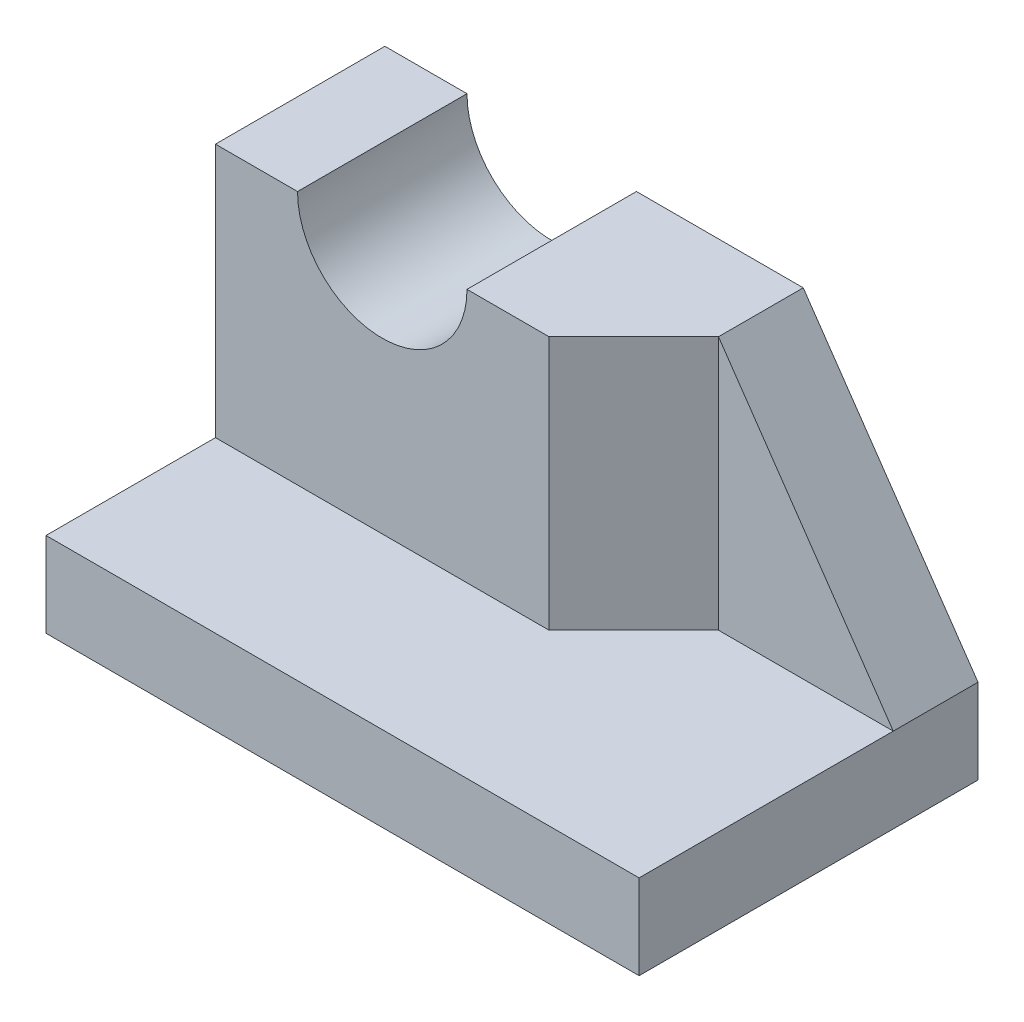
from build123d import *

# Parameters (mm, degrees)
SKETCH1_W               = 70
SKETCH1_H               = 40
BOSS_EXTRUDE1_DEPTH     = 10
BOSS_EXTRUDE2_DEPTH     = 30
CUT_EXTRUDE1_DEPTH      = 57.789083458
CUT_EXTRUDE1_DEPTH_BACK = 57.789083458
SKETCH3_OUTSIDE_W       = 90
SKETCH3_OUTSIDE_H       = 60


with BuildPart() as part:
    # Sketch1 → Boss-Extrude1 (new body)
    with BuildSketch(Plane(origin=(0, 0, 0), x_dir=(1, 0, 0), z_dir=(0, 1, 0))):
        Rectangle(SKETCH1_W, SKETCH1_H)
    extrude(amount=BOSS_EXTRUDE1_DEPTH)

    # Sketch2 → Boss-Extrude2 (add)
    with BuildSketch(Plane(origin=(0, 10, 0), x_dir=(1, 0, 0), z_dir=(0, 1, 0))):
        Polygon((-35, 20), (-35, 0), (4.372843299, 0), (14.372843299, 10), (35, 10), (35, 20), align=None)
    extrude(amount=BOSS_EXTRUDE2_DEPTH)

    # Sketch3 outside → Cut-Extrude1 (cut, two sides: drawn at the far end of the back side and taken through both)
    with BuildSketch(Plane.XY.offset(-CUT_EXTRUDE1_DEPTH_BACK)):
        with Locations((0, 20)):
            Rectangle(SKETCH3_OUTSIDE_W, SKETCH3_OUTSIDE_H)
        with BuildLine():
            Line((-25.31357835, 40), (-35, 40))
            Line((-35, 40), (-35, 0))
            Line((-35, 0), (35, 0))
            Line((35, 0), (35, 10))
            Line((35, 10), (14.372843299, 40))
            Line((14.372843299, 40), (-5.31357835, 40))
            ThreePointArc((-5.31357835, 40), (-15.31357835, 30), (-25.31357835, 40))
        make_face(mode=Mode.SUBTRACT)
    extrude(amount=CUT_EXTRUDE1_DEPTH + CUT_EXTRUDE1_DEPTH_BACK, mode=Mode.SUBTRACT)


solid = part.part
